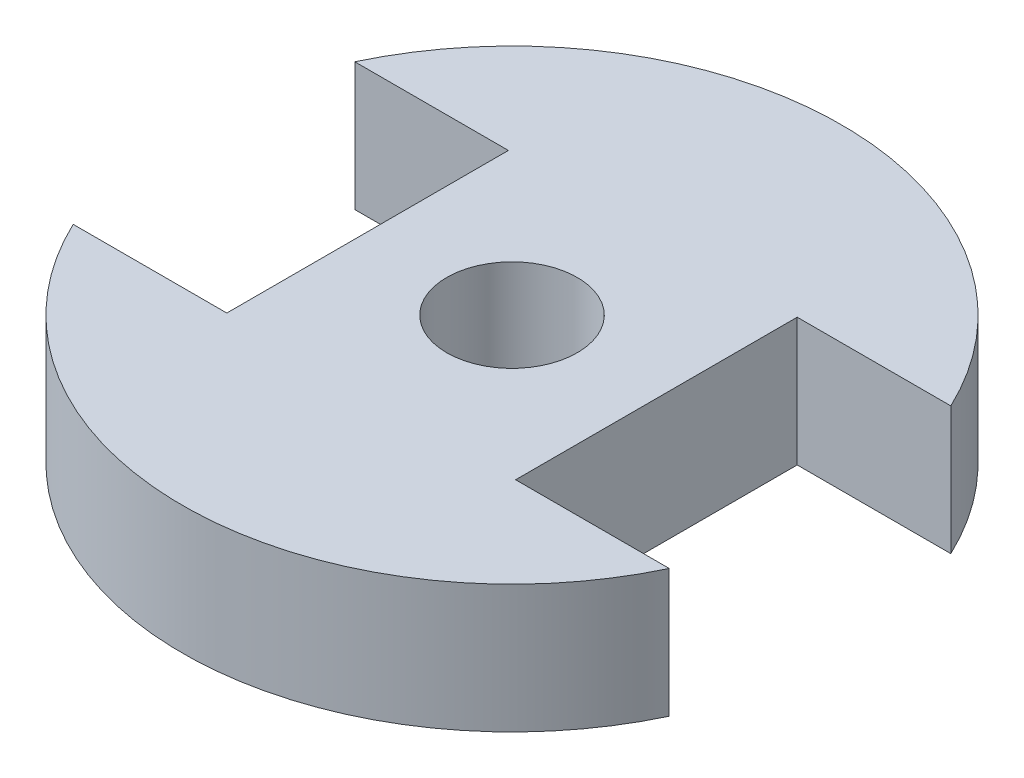
from build123d import *

# Parameters (mm, degrees)
SKETCH1_R           = 2.55
BOSS_EXTRUDE1_DEPTH = 5


with BuildPart() as part:
    # Sketch1 → Boss-Extrude1 (new body)
    with BuildSketch(Plane(origin=(0, 0, 0), x_dir=(1, 0, 0), z_dir=(0, 1, 0))):
        with BuildLine():
            Line((-11.641117859, 5.5), (-5.641117859, 5.5))
            Line((-5.641117859, 5.5), (-5.641117859, -5.5))
            Line((-5.641117859, -5.5), (-11.641117859, -5.5))
            ThreePointArc((-11.641117859, -5.5), (0, -12.875), (11.641117859, -5.5))
            Line((11.641117859, -5.5), (5.641117859, -5.5))
            Line((5.641117859, -5.5), (5.641117859, 5.5))
            Line((5.641117859, 5.5), (11.641117859, 5.5))
            ThreePointArc((11.641117859, 5.5), (0, 12.875), (-11.641117859, 5.5))
        make_face()
        with Locations(Location((0, 0, 0), (0, 0, 270))):
            Circle(SKETCH1_R, mode=Mode.SUBTRACT)
    extrude(amount=BOSS_EXTRUDE1_DEPTH)


solid = part.part
